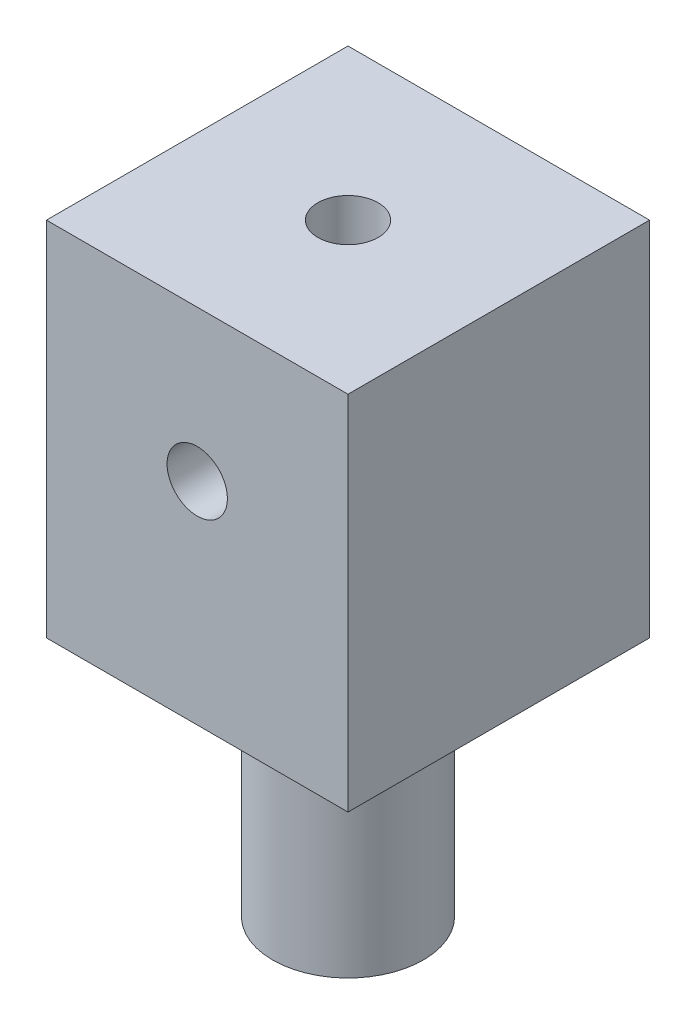
from build123d import *

# Parameters (mm, degrees)
SKETCH3_R               = 15.875
BOSS_EXTRUDE1_DEPTH     = 63.5
BOSS_EXTRUDE2_START     = -12.7
SKETCH4_W               = 63.5
SKETCH4_H               = 63.5
SKETCH4_R               = 15.875
SKETCH4_R_2             = 6.35
BOSS_EXTRUDE2_DEPTH     = 76.2
CUT_EXTRUDE1_REACH      = 147.497
CUT_EXTRUDE1_END_RADIUS = 6.35
SKETCH5_R               = 6.35


with BuildPart() as part:
    # Sketch3 → Boss-Extrude1 (new body)
    with BuildSketch(Plane(origin=(0, 0, 0), x_dir=(1, 0, 0), z_dir=(0, 1, 0))):
        with Locations(Location((0, 0, 0), (0, 0, 270))):
            Circle(SKETCH3_R)
    extrude(amount=BOSS_EXTRUDE1_DEPTH)


with BuildPart() as body_2:
    # Sketch4 → Boss-Extrude2 (new body)
    # profile 1 of 2: a face of its own
    with BuildSketch(Plane(origin=(0, 63.5, 0), x_dir=(1, 0, 0), z_dir=(0, 1, 0)).offset(BOSS_EXTRUDE2_START)):
        Rectangle(SKETCH4_W, SKETCH4_H)
        with Locations(Location((0, 0, 0), (0, 0, 270))):
            Circle(SKETCH4_R, mode=Mode.SUBTRACT)
    # profile 2 of 2: a face of its own
    with BuildSketch(Plane(origin=(0, 63.5, 0), x_dir=(1, 0, 0), z_dir=(0, 1, 0)).offset(BOSS_EXTRUDE2_START)):
        with Locations(Location((0, 0, 0), (0, 0, 270))):
            Circle(SKETCH4_R)
        with Locations(Location((0, 0, 0), (0, 0, 90))):
            Circle(SKETCH4_R_2, mode=Mode.SUBTRACT)
    extrude(amount=BOSS_EXTRUDE2_DEPTH)

    # Cut-Extrude1: up to this cylinder (the profile starts outside it)
    cut_extrude1_end = Plane(origin=(0, 95.25, 0), z_dir=(0, -1, 0)) * Cylinder(CUT_EXTRUDE1_END_RADIUS, 308.694, mode=Mode.PRIVATE)
    # Sketch5 → Cut-Extrude1 (cut, up to the surface)
    with BuildSketch(Plane.XY.offset(31.75), mode=Mode.PRIVATE) as cut_extrude1_sk1:
        with Locations((0, 95.25)):
            Circle(SKETCH5_R)
    cut_extrude1_tool1 = extrude(cut_extrude1_sk1.sketch, amount=-CUT_EXTRUDE1_REACH, mode=Mode.PRIVATE) - cut_extrude1_end
    add(cut_extrude1_tool1.solids().sort_by_distance((0, 95.25, 31.75))[0], mode=Mode.SUBTRACT)


with BuildPart() as part_1:
    add(part.part)

    # Combine1: union body 2
    add(body_2.part)


solid = part_1.part
